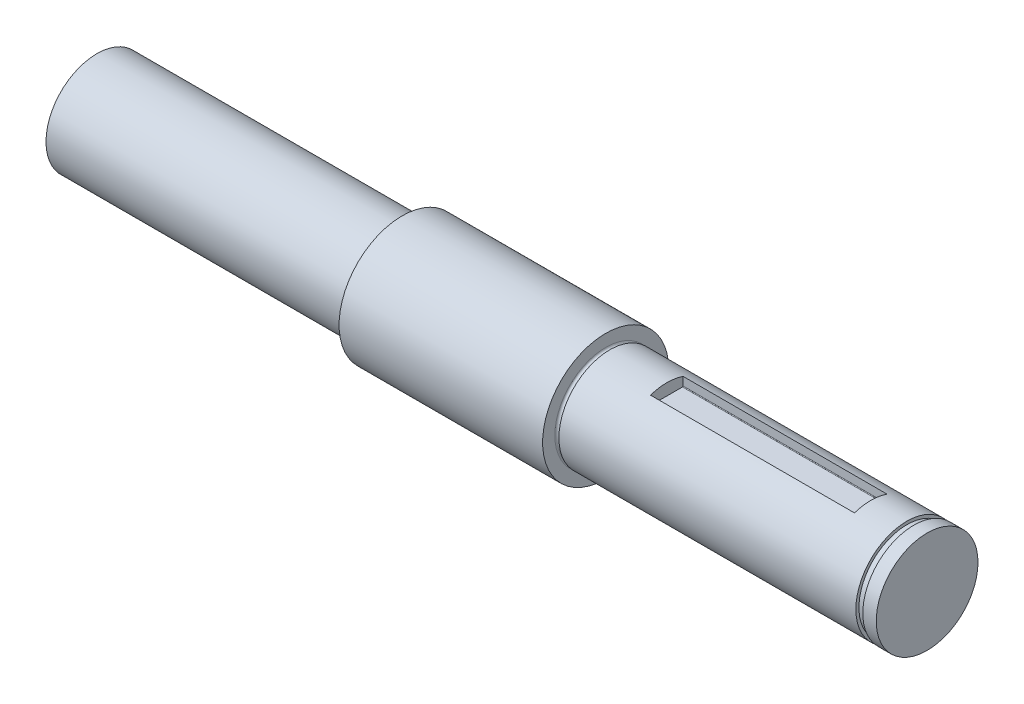
from build123d import *

# Parameters (mm, degrees)
SKETCH1_R           = 31
BOSS_EXTRUDE1_DEPTH = 50
SKETCH1_4_R         = 25
BOSS_EXTRUDE2_DEPTH = 200
CUT_EXTRUDE1_START  = 130.215
CUT_EXTRUDE1_DEPTH  = 100.215
BOSS_EXTRUDE3_START = 7.91
SKETCH5_R           = 25
BOSS_EXTRUDE3_DEPTH = 7.91
CUT_EXTRUDE2_START  = -6.6
SKETCH6_R           = 25
SKETCH6_R_2         = 23.5
CUT_EXTRUDE2_DEPTH  = 3.4


with BuildPart() as part:
    # Sketch1 → Boss-Extrude1 (new, symmetric)
    with BuildSketch(Plane(origin=(0, 0, 0), x_dir=(0, 0, -1), z_dir=(1, 0, 0))):
        Circle(SKETCH1_R)
    extrude(amount=BOSS_EXTRUDE1_DEPTH, both=True)

    # Sketch1<4> → Boss-Extrude2 (add, symmetric)
    with BuildSketch(Plane(origin=(0, 0, 0), x_dir=(0, 0, -1), z_dir=(1, 0, 0))):
        Circle(SKETCH1_4_R)
    extrude(amount=BOSS_EXTRUDE2_DEPTH, both=True)

    # Sketch3 → Cut-Revolve1 (revolve, cut)
    with BuildSketch(Plane.XY):
        with BuildLine():
            Line((52, 25), (50, 25))
            ThreePointArc((50, 25), (51, 24), (52, 25))
        make_face()
        with BuildLine():
            Line((-52, 25), (-50, 25))
            ThreePointArc((-50, 25), (-51, 24), (-52, 25))
        make_face()
    revolve(axis=Axis((0, 0, 0), (1, 0, 0)), mode=Mode.SUBTRACT)

    # Sketch4 → Cut-Extrude1 (cut)
    with BuildSketch(Plane(origin=(50, 0, 0), x_dir=(0, 0, -1), z_dir=(1, 0, 0)).offset(CUT_EXTRUDE1_START)):
        with BuildLine():
            Line((-8, 23.685438565), (-8, 19.6))
            ThreePointArc((-8, 19.6), (-7.912132034, 19.387867966), (-7.7, 19.3))
            Line((-7.7, 19.3), (7.7, 19.3))
            ThreePointArc((7.7, 19.3), (7.912132034, 19.387867966), (8, 19.6))
            Line((8, 19.6), (8, 23.685438565))
            ThreePointArc((8, 23.685438565), (0, 25), (-8, 23.685438565))
        make_face()
    extrude(amount=-CUT_EXTRUDE1_DEPTH, mode=Mode.SUBTRACT)

    # Sketch5 → Boss-Extrude3 (add)
    with BuildSketch(Plane(origin=(200, 0, 0), x_dir=(0, 0, -1), z_dir=(1, 0, 0)).offset(BOSS_EXTRUDE3_START)):
        Circle(SKETCH5_R)
    extrude(amount=-BOSS_EXTRUDE3_DEPTH)

    # Sketch6 → Cut-Extrude2 (cut)
    with BuildSketch(Plane(origin=(207.91, 0, 0), x_dir=(0, 0, -1), z_dir=(1, 0, 0)).offset(CUT_EXTRUDE2_START)):
        Circle(SKETCH6_R)
        Circle(SKETCH6_R_2, mode=Mode.SUBTRACT)
    extrude(amount=-CUT_EXTRUDE2_DEPTH, mode=Mode.SUBTRACT)


solid = part.part
